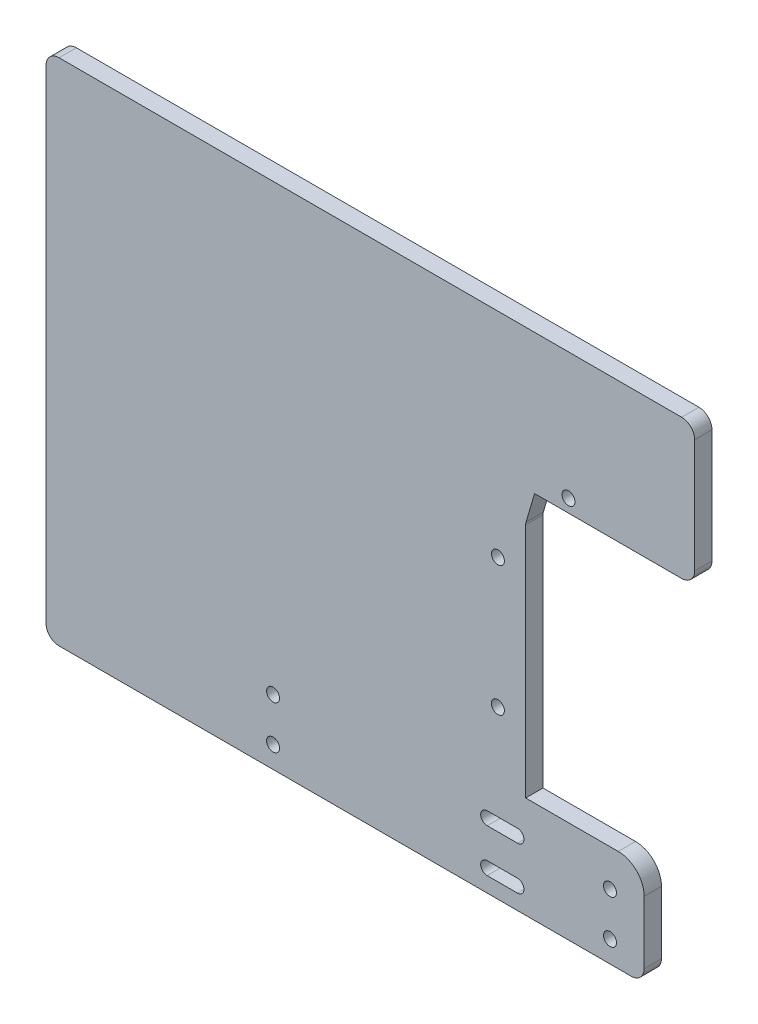
from build123d import *

# Parameters (mm, degrees)
SKETCH_2_R      = 1.5
EXTRUDE_3_DEPTH = 4
FILLET_2_R      = 3


with BuildPart() as part:
    # 草图2 → 凸台-拉伸3 (new body)
    with BuildSketch(Plane.XY):
        with BuildLine():
            Line((66.624685503, 252.532138716), (-83.375314497, 252.532138716))
            Line((-83.375314497, 252.532138716), (-83.375314497, 134.732138716))
            Line((-83.375314497, 134.732138716), (54.944685503, 134.732138716))
            Line((54.944685503, 134.732138716), (54.944685503, 152.232138716))
            ThreePointArc((54.944685503, 152.232138716), (53.18732619, 156.474779403), (48.944685503, 158.232138716))
            Line((48.944685503, 158.232138716), (27.544685503, 158.232138716))
            Line((27.544685503, 158.232138716), (27.544685503, 212.944120657))
            ThreePointArc((27.544685503, 212.944120657), (27.565107012, 213.229197834), (27.6259545, 213.508453305))
            Line((27.6259545, 213.508453305), (29.603509033, 220.232138716))
            Line((29.603509033, 220.232138716), (66.624685503, 220.232138716))
            Line((66.624685503, 220.232138716), (66.624685503, 252.532138716))
        make_face()
        with Locations((-30.875314497, 139.732138716)):
            Circle(SKETCH_2_R, mode=Mode.SUBTRACT)
        with Locations((-30.875314497, 149.732138716)):
            Circle(SKETCH_2_R, mode=Mode.SUBTRACT)
        with Locations((21.124685503, 173.232138716)):
            Circle(SKETCH_2_R, mode=Mode.SUBTRACT)
        with Locations((21.124685503, 203.232138716)):
            Circle(SKETCH_2_R, mode=Mode.SUBTRACT)
        with BuildLine():
            Line((18.644685503, 151.232138716), (25.644685503, 151.232138716))
            ThreePointArc((25.644685503, 151.232138716), (27.144685503, 149.732138716), (25.644685503, 148.232138716))
            Line((25.644685503, 148.232138716), (18.644685503, 148.232138716))
            ThreePointArc((18.644685503, 148.232138716), (17.144685503, 149.732138716), (18.644685503, 151.232138716))
        make_face(mode=Mode.SUBTRACT)
        with BuildLine():
            Line((25.644685503, 138.232138716), (18.644685503, 138.232138716))
            ThreePointArc((18.644685503, 138.232138716), (17.144685503, 139.732138716), (18.644685503, 141.232138716))
            Line((18.644685503, 141.232138716), (25.644685503, 141.232138716))
            ThreePointArc((25.644685503, 141.232138716), (27.144685503, 139.732138716), (25.644685503, 138.232138716))
        make_face(mode=Mode.SUBTRACT)
        with Locations((37.444685503, 223.232138716)):
            Circle(SKETCH_2_R, mode=Mode.SUBTRACT)
        with Locations((47.044685503, 149.732138716)):
            Circle(SKETCH_2_R, mode=Mode.SUBTRACT)
        with Locations((47.044685503, 139.732138716)):
            Circle(SKETCH_2_R, mode=Mode.SUBTRACT)
    extrude(amount=EXTRUDE_3_DEPTH)

    # 圆角2
    fillet_2_edges = [part.edges().sort_by_distance(p)[0] for p in [
        (-83.375314497, 134.732138716, 2),
        (-83.375314497, 252.532138716, 2),
        (66.624685503, 252.532138716, 2),
        (66.624685503, 220.232138716, 2),
        (54.944685503, 134.732138716, 2),
    ]]
    fillet(fillet_2_edges, radius=FILLET_2_R)


solid = part.part
